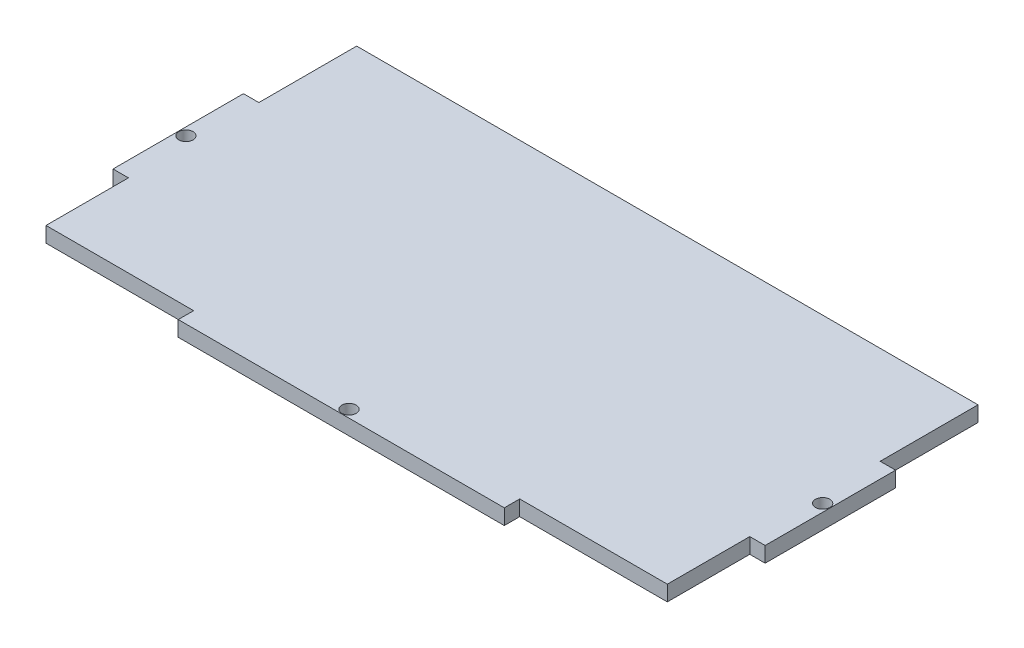
from build123d import *

# Parameters (mm, degrees)
SKETCH1_W           = 127
SKETCH1_H           = 63.5
BOSS_EXTRUDE1_DEPTH = 2.9972
CUT_EXTRUDE1_REACH  = 73.058
SKETCH2_R           = 1.397
SKETCH2_W           = 2.9972
SKETCH2_H           = 19.05


with BuildPart() as part:
    # Sketch1 → Boss-Extrude1 (new body)
    with BuildSketch(Plane(origin=(0, 0, 0), x_dir=(1, 0, 0), z_dir=(0, 1, 0))):
        Rectangle(SKETCH1_W, SKETCH1_H)
    extrude(amount=BOSS_EXTRUDE1_DEPTH)

    # Sketch2 → Cut-Extrude1 (cut, up to next)
    with BuildSketch(Plane(origin=(0, 2.9972, 0), x_dir=(1, 0, 0), z_dir=(0, 1, 0)), mode=Mode.PRIVATE) as cut_extrude1_sk1:
        with Locations(Location((0, -30.2514, 0), (0, 0, 90))):
            Circle(SKETCH2_R)
    cut_extrude1_tool1 = extrude(cut_extrude1_sk1.sketch, amount=-CUT_EXTRUDE1_REACH, mode=Mode.PRIVATE) & part.part
    # Sketch2 → Cut-Extrude1 (cut, up to next)
    with BuildSketch(Plane(origin=(0, 2.9972, 0), x_dir=(1, 0, 0), z_dir=(0, 1, 0)), mode=Mode.PRIVATE) as cut_extrude1_sk2:
        with Locations(Location((-62.0014, 0, 0), (0, 0, 270))):
            Circle(SKETCH2_R)
    cut_extrude1_tool2 = extrude(cut_extrude1_sk2.sketch, amount=-CUT_EXTRUDE1_REACH, mode=Mode.PRIVATE) & part.part
    # Sketch2 → Cut-Extrude1 (cut, up to next)
    with BuildSketch(Plane(origin=(0, 2.9972, 0), x_dir=(1, 0, 0), z_dir=(0, 1, 0)), mode=Mode.PRIVATE) as cut_extrude1_sk3:
        with Locations(Location((62.0014, 0, 0), (0, 0, 90))):
            Circle(SKETCH2_R)
    cut_extrude1_tool3 = extrude(cut_extrude1_sk3.sketch, amount=-CUT_EXTRUDE1_REACH, mode=Mode.PRIVATE) & part.part
    # Sketch2 → Cut-Extrude1 (cut, up to next)
    with BuildSketch(Plane(origin=(0, 2.9972, 0), x_dir=(1, 0, 0), z_dir=(0, 1, 0)), mode=Mode.PRIVATE) as cut_extrude1_sk4:
        Polygon((63.5, -31.75), (31.75, -31.75), (31.75, -28.7528), (60.5028, -28.7528), (60.5028, -12.7), (63.5, -12.7), (63.5, -28.7528), align=None)
    cut_extrude1_tool4 = extrude(cut_extrude1_sk4.sketch, amount=-CUT_EXTRUDE1_REACH, mode=Mode.PRIVATE) & part.part
    # Sketch2 → Cut-Extrude1 (cut, up to next)
    with BuildSketch(Plane(origin=(0, 2.9972, 0), x_dir=(1, 0, 0), z_dir=(0, 1, 0)), mode=Mode.PRIVATE) as cut_extrude1_sk5:
        with Locations((-62.0014, 22.225)):
            Rectangle(SKETCH2_W, SKETCH2_H)
    cut_extrude1_tool5 = extrude(cut_extrude1_sk5.sketch, amount=-CUT_EXTRUDE1_REACH, mode=Mode.PRIVATE) & part.part
    # Sketch2 → Cut-Extrude1 (cut, up to next)
    with BuildSketch(Plane(origin=(0, 2.9972, 0), x_dir=(1, 0, 0), z_dir=(0, 1, 0)), mode=Mode.PRIVATE) as cut_extrude1_sk6:
        Polygon((-63.5, -31.75), (-31.75, -31.75), (-31.75, -28.7528), (-60.5028, -28.7528), (-60.5028, -12.7), (-63.5, -12.7), (-63.5, -28.7528), align=None)
    cut_extrude1_tool6 = extrude(cut_extrude1_sk6.sketch, amount=-CUT_EXTRUDE1_REACH, mode=Mode.PRIVATE) & part.part
    # Sketch2 → Cut-Extrude1 (cut, up to next)
    with BuildSketch(Plane(origin=(0, 2.9972, 0), x_dir=(1, 0, 0), z_dir=(0, 1, 0)), mode=Mode.PRIVATE) as cut_extrude1_sk7:
        with Locations((62.0014, 22.225)):
            Rectangle(SKETCH2_W, SKETCH2_H)
    cut_extrude1_tool7 = extrude(cut_extrude1_sk7.sketch, amount=-CUT_EXTRUDE1_REACH, mode=Mode.PRIVATE) & part.part
    add(cut_extrude1_tool1.solids().sort_by_distance((0, 2.9972, 30.2514))[0], mode=Mode.SUBTRACT)
    add(cut_extrude1_tool2.solids().sort_by_distance((-62.0014, 2.9972, 0))[0], mode=Mode.SUBTRACT)
    add(cut_extrude1_tool3.solids().sort_by_distance((62.0014, 2.9972, 0))[0], mode=Mode.SUBTRACT)
    add(cut_extrude1_tool4.solids().sort_by_distance((47.625, 2.9972, 31.379735))[0], mode=Mode.SUBTRACT)
    add(cut_extrude1_tool5.solids().sort_by_distance((-62.0014, 2.9972, -22.225))[0], mode=Mode.SUBTRACT)
    add(cut_extrude1_tool6.solids().sort_by_distance((-47.625, 2.9972, 31.379735))[0], mode=Mode.SUBTRACT)
    add(cut_extrude1_tool7.solids().sort_by_distance((62.0014, 2.9972, -22.225))[0], mode=Mode.SUBTRACT)


solid = part.part
